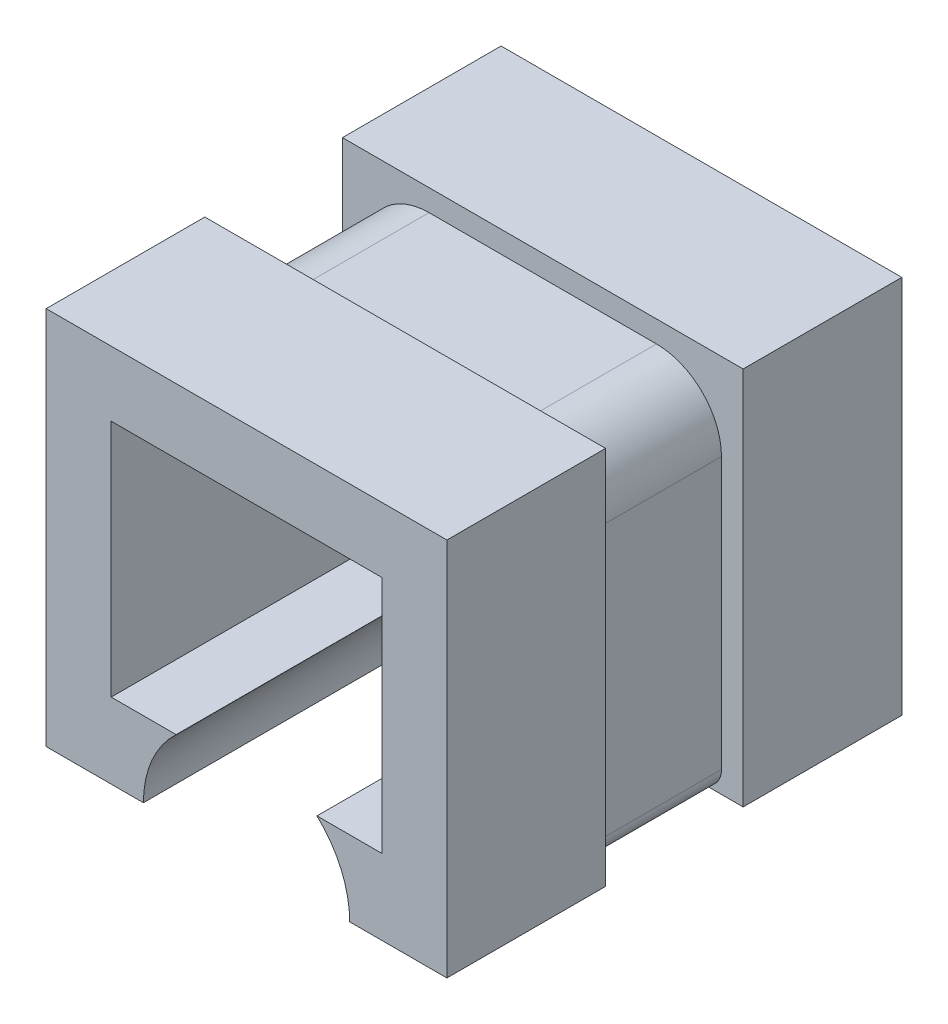
from build123d import *

# Parameters (mm, degrees)
BOSS_EXTRUDE1_DEPTH = 10.5
CUT_EXTRUDE1_DEPTH  = 3.175
FILLET1_R           = 3
FILLET2_R           = 1


with BuildPart() as part:
    # Sketch1 → Boss-Extrude1 (new, symmetric)
    with BuildSketch(Plane.XY):
        with BuildLine():
            Line((-4.7625, 0), (-9.25, 0))
            Line((-9.25, 0), (-9.25, 17.5125))
            Line((-9.25, 17.5125), (9.25, 17.5125))
            Line((9.25, 17.5125), (9.25, 0))
            Line((9.25, 0), (4.7625, 0))
            ThreePointArc((4.7625, 0), (4.368039105, 1.89779889), (3.25, 3.481221948))
            Line((3.25, 3.481221948), (6.25, 3.481221948))
            Line((6.25, 3.481221948), (6.25, 14.5125))
            Line((6.25, 14.5125), (-6.25, 14.5125))
            Line((-6.25, 14.5125), (-6.25, 3.481221948))
            Line((-6.25, 3.481221948), (-3.25, 3.481221948))
            ThreePointArc((-3.25, 3.481221948), (-4.368039105, 1.89779889), (-4.7625, 0))
        make_face()
    extrude(amount=BOSS_EXTRUDE1_DEPTH, both=True)

    # Sketch2 → Cut-Extrude1 (cut, symmetric)
    with BuildSketch(Plane.XY):
        Polygon((0, 17.5125), (-9.25, 17.5125), (-9.25, 0), (-8.25, 0), (-8.25, 16.5125), (0, 16.5125), align=None)
    cut_extrude1 = extrude(amount=CUT_EXTRUDE1_DEPTH, both=True, mode=Mode.SUBTRACT)

    # Mirror1: Cut-Extrude1 across plane
    add(cut_extrude1.mirror(Plane(origin=(0, 0, 0), x_dir=(0, 0, 1), z_dir=(1, 0, 0))), mode=Mode.SUBTRACT)

    # Fillet1
    fillet1_edges = [part.edges().sort_by_distance(p)[0] for p in [
        (-8.25, 16.5125, 0),
        (8.25, 16.5125, 0),
    ]]
    fillet(fillet1_edges, radius=FILLET1_R)

    # Fillet2
    fillet2_edges = [part.edges().sort_by_distance(p)[0] for p in [
        (-8.25, 0, 0),
        (8.25, 0, 0),
    ]]
    fillet(fillet2_edges, radius=FILLET2_R)


solid = part.part
